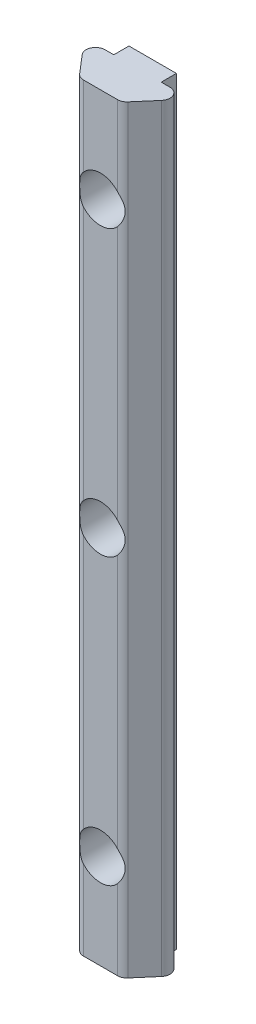
from build123d import *

# Parameters (mm, degrees)
BOSS_EXTRUDE1_DEPTH = 101.6
SKETCH2_R           = 3.048
CUT_EXTRUDE4_DEPTH  = 127


with BuildPart() as part:
    # Sketch1 → Boss-Extrude1 (new body)
    with BuildSketch(Plane(origin=(0, 0, 0), x_dir=(1, 0, 0), z_dir=(0, 1, 0))):
        with BuildLine():
            Line((0.583306021, 0), (5.131693979, 0))
            ThreePointArc((5.131693979, 0), (5.661763503, 0.115908886), (6.095077487, 0.442478269))
            Line((6.095077487, 0.442478269), (8.167782615, 2.855478269))
            ThreePointArc((8.167782615, 2.855478269), (8.358490221, 4.213069524), (7.204399107, 4.953))
            Line((7.204399107, 4.953), (6.0325, 4.953))
            Line((6.0325, 4.953), (6.0325, 6.985))
            Line((6.0325, 6.985), (-0.3175, 6.985))
            Line((-0.3175, 6.985), (-0.3175, 4.953))
            Line((-0.3175, 4.953), (-1.489399107, 4.953))
            ThreePointArc((-1.489399107, 4.953), (-2.643490221, 4.213069524), (-2.452782615, 2.855478269))
            Line((-2.452782615, 2.855478269), (-0.380077487, 0.442478269))
            ThreePointArc((-0.380077487, 0.442478269), (0.053236497, 0.115908886), (0.583306021, 0))
        make_face()
    extrude(amount=BOSS_EXTRUDE1_DEPTH)

    # Sketch2 → Cut-Extrude4 (cut)
    with BuildSketch(Plane(origin=(0, 0, -6.985), x_dir=(-1, 0, 0), z_dir=(0, 0, -1))):
        with Locations((-2.8575, 50.8)):
            Circle(SKETCH2_R)
        with Locations((-2.8575, 88.9)):
            Circle(SKETCH2_R)
        with Locations((-2.8575, 12.7)):
            Circle(SKETCH2_R)
    extrude(amount=-CUT_EXTRUDE4_DEPTH, mode=Mode.SUBTRACT)


solid = part.part
